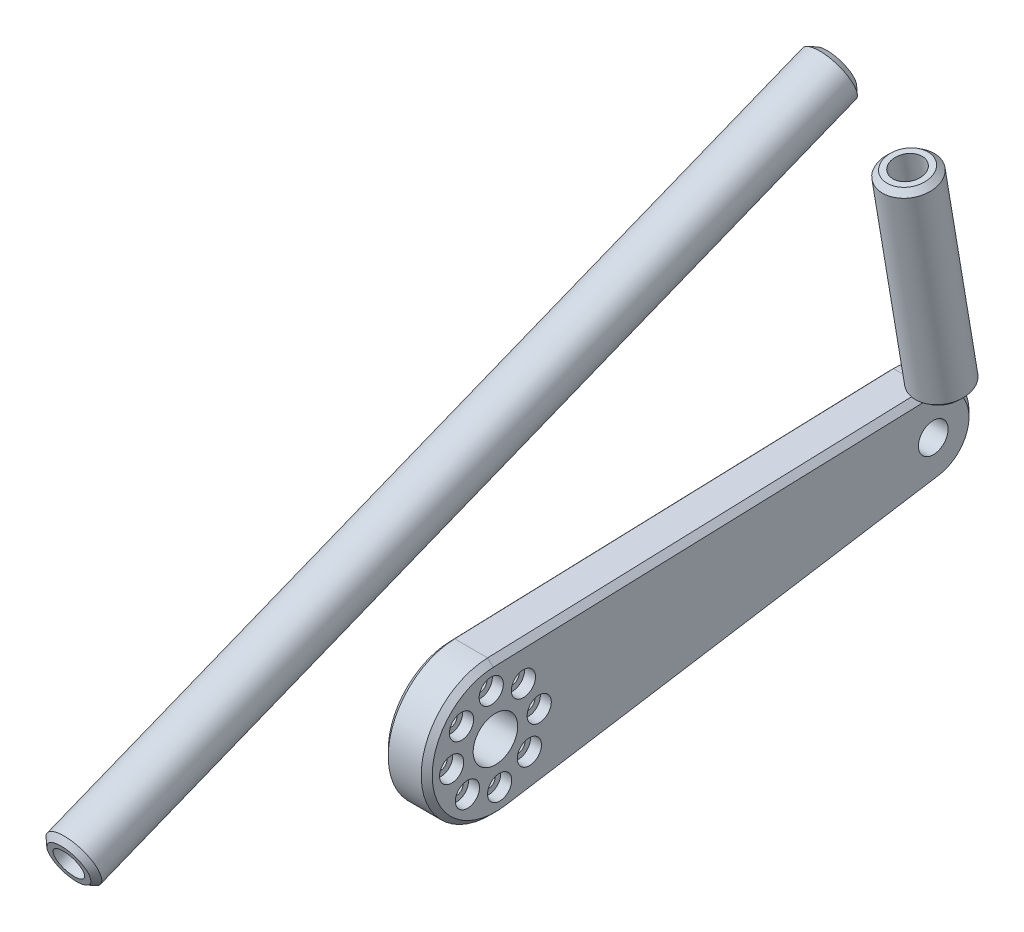
from build123d import *

# Parameters (mm, degrees)
SKETCH2_R                      = 4.05
SKETCH2_R_2                    = 2.7
BOSS_EXTRUDE1_DEPTH            = 8
CBORE_FOR_M2_SHCS1_D           = 2.4
CBORE_FOR_M2_SHCS1_CBORE_D     = 4.4
CBORE_FOR_M2_SHCS1_CBORE_DEPTH = 2
CHAMFER2_SIZE                  = 1
CHAMFER1_SIZE                  = 1
CHAMFER3_SIZE                  = 1


with BuildPart() as part:
    # Sketch2 → Boss-Extrude1 (new body)
    with BuildSketch(Plane(origin=(0, 0, 0), x_dir=(0, 0, -1), z_dir=(1, 0, 0))):
        with BuildLine():
            Line((-0.41665925, 12.493053873), (79.38256956, 15.154459739))
            ThreePointArc((79.38256956, 15.154459739), (87.09811809, 8.376623735), (80.815754783, 0.252544632))
            Line((80.815754783, 0.252544632), (1.971982788, -12.343471306))
            ThreePointArc((1.971982788, -12.343471306), (-12.442588299, -1.196660534), (-0.41665925, 12.493053873))
        make_face()
        Circle(SKETCH2_R, mode=Mode.SUBTRACT)
        with Locations((79.632565111, 7.658627415)):
            Circle(SKETCH2_R_2, mode=Mode.SUBTRACT)
    extrude(amount=BOSS_EXTRUDE1_DEPTH)

    # CBORE for M2 SHCS1 (through all)
    with Locations(Plane(origin=(8, 0, 0), x_dir=(0, 0, -1), z_dir=(1, 0, 0))):
        with Locations((7.963256511, 0.765862742), (6.172419417, -5.089325941), (0.765862742, -7.963256511), (-5.089325941, -6.172419417), (-7.963256511, -0.765862742), (-6.172419417, 5.089325941), (-0.765862742, 7.963256511), (5.089325941, 6.172419417)):
            CounterBoreHole(CBORE_FOR_M2_SHCS1_D / 2, CBORE_FOR_M2_SHCS1_CBORE_D / 2, CBORE_FOR_M2_SHCS1_CBORE_DEPTH)

    # Chamfer1
    chamfer1_edges = [part.edges().sort_by_distance(p)[0] for p in [
        (8, 8.376623735, -87.09811809),
        (8, 13.823756806, -39.482955155),
        (8, -1.196660534, 12.442588299),
        (0, 13.823756806, -39.482955155),
        (0, 8.376623735, -87.09811809),
        (0, -6.045463337, -41.393868786),
        (0, -1.196660534, 12.442588299),
        (8, -6.045463337, -41.393868786),
    ]]
    chamfer(chamfer1_edges, length=CHAMFER1_SIZE)


with BuildPart() as body_2:
    # Sketch7 → Revolve1 (revolve)
    with BuildSketch(Plane(origin=(0, 13.230763187, -78.695746899), x_dir=(1, 0, 0), z_dir=(0, -0.16579859905604952, 0.9861596344157731)), mode=Mode.PRIVATE) as revolve1_sk:
        Polygon((11.45, 20.349661477), (13.45, 20.349661477), (13.45, 13.349661477), (14.15, 13.349661477), (14.15, 5.349661477), (16.2125, 5.349661477), (16.2125, 43.349661477), (14.15, 43.349661477), (14.15, 35.349661477), (13.45, 35.349661477), (13.45, 28.349661477), (11.45, 28.349661477), align=None)
    revolve(revolve1_sk.sketch.rotate(Axis((11.45, 7.658627415, -79.632565111), (0, 0.9861596344157731, 0.16579859905604957)), 90), axis=Axis((11.45, 7.658627415, -79.632565111), (0, 0.9861596344157731, 0.16579859905604957)))

    # Chamfer2
    chamfer2_edges = [body_2.edges().sort_by_distance(p)[0] for p in [
        (11.45, 55.190833674, -66.811848498),
        (11.45, 17.716767566, -73.112195262),
    ]]
    chamfer(chamfer2_edges, length=CHAMFER2_SIZE)


with BuildPart() as body_3:
    # Sketch8 → Revolve2 (revolve)
    with BuildSketch(Plane(origin=(0, 33.59410897, 13.432487089), x_dir=(0, 0.3712678082232227, -0.928525828707594), z_dir=(0, -0.9285258287075941, -0.37126780822322275)), mode=Mode.PRIVATE) as revolve2_sk:
        Polygon((-45.484842008, 0), (74.515157992, 0), (74.515157992, 1.75), (81.515157992, 1.75), (81.515157992, 2.7), (89.515157992, 2.7), (89.515157992, 4.7625), (-60.484842008, 4.7625), (-60.484842008, 2.7), (-52.484842008, 2.7), (-52.484842008, 1.75), (-45.484842008, 1.75), align=None)
    revolve(revolve2_sk.sketch.rotate(Axis((0, 0, 97.45), (0, 0.37126780822322275, -0.9285258287075941)), 90), axis=Axis((0, 0, 97.45), (0, 0.37126780822322275, -0.9285258287075941)))

    # Chamfer3
    chamfer3_edges = [body_3.edges().sort_by_distance(p)[0] for p in [
        (0, 71.250309739, -67.916486231),
        (0, 15.560138506, 71.362388075),
    ]]
    chamfer(chamfer3_edges, length=CHAMFER3_SIZE)


solid = Compound([part.part, body_2.part, body_3.part])
